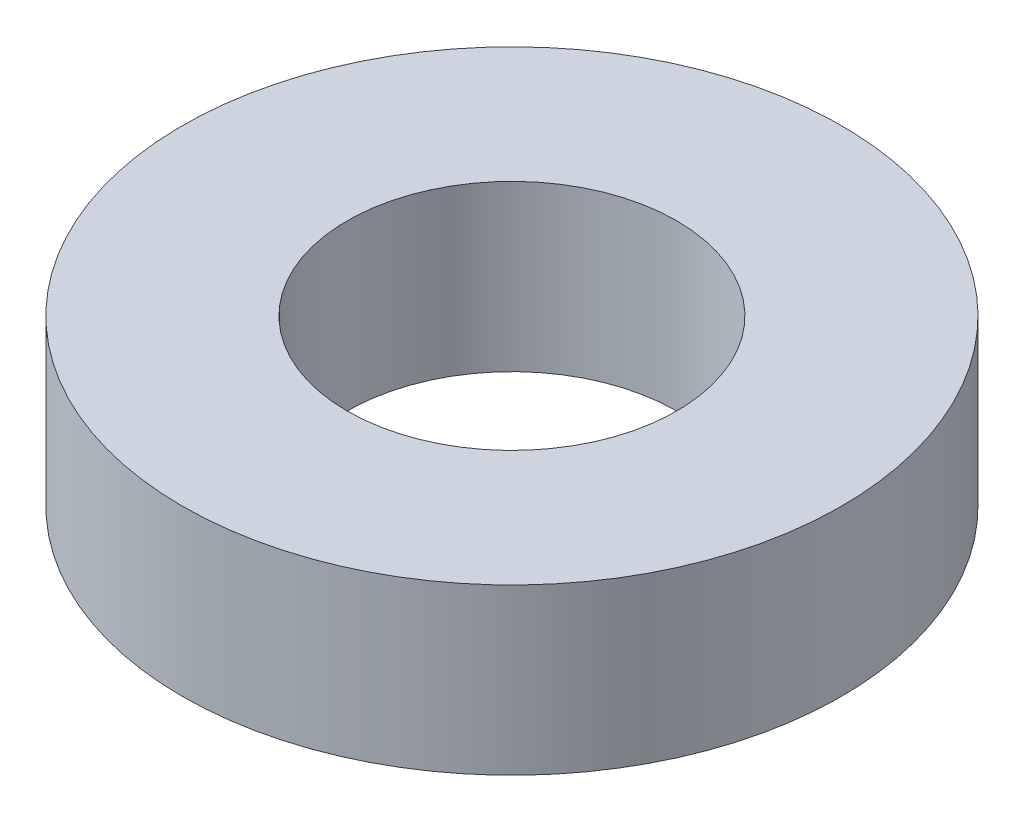
from build123d import *

# Parameters (mm, degrees)
SKETCH_1_R      = 40
SKETCH_1_R_2    = 20
EXTRUDE_1_DEPTH = 20


with BuildPart() as part:
    # 草图1 → 凸台-拉伸1 (new body)
    with BuildSketch(Plane(origin=(0, 0, 0), x_dir=(1, 0, 0), z_dir=(0, 1, 0))):
        with Locations(Location((0, 0, 0), (0, 0, 270))):
            Circle(SKETCH_1_R)
        with Locations(Location((0, 0, 0), (0, 0, 270))):
            Circle(SKETCH_1_R_2, mode=Mode.SUBTRACT)
    extrude(amount=EXTRUDE_1_DEPTH)


solid = part.part
